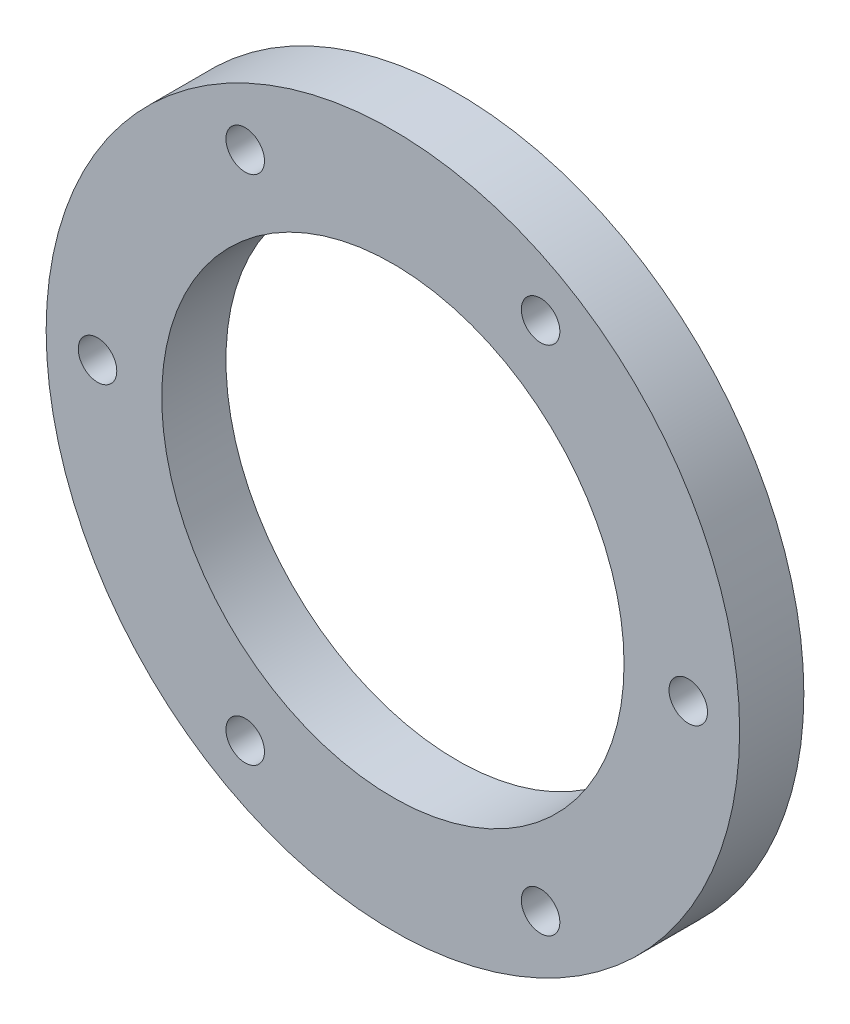
from build123d import *

# Parameters (mm, degrees)
SKETCH1_R           = 27
SKETCH1_R_2         = 18
SKETCH1_R_3         = 1.5
BOSS_EXTRUDE1_DEPTH = 5


with BuildPart() as part:
    # Sketch1 → Boss-Extrude1 (new body)
    with BuildSketch(Plane.XY):
        Circle(SKETCH1_R)
        Circle(SKETCH1_R_2, mode=Mode.SUBTRACT)
        with Locations((-11.5, 19.918584287)):
            Circle(SKETCH1_R_3, mode=Mode.SUBTRACT)
        with Locations((-23, 0)):
            Circle(SKETCH1_R_3, mode=Mode.SUBTRACT)
        with Locations((-11.5, -19.918584287)):
            Circle(SKETCH1_R_3, mode=Mode.SUBTRACT)
        with Locations((11.5, -19.918584287)):
            Circle(SKETCH1_R_3, mode=Mode.SUBTRACT)
        with Locations((23, 0)):
            Circle(SKETCH1_R_3, mode=Mode.SUBTRACT)
        with Locations((11.5, 19.918584287)):
            Circle(SKETCH1_R_3, mode=Mode.SUBTRACT)
    extrude(amount=BOSS_EXTRUDE1_DEPTH)


solid = part.part
